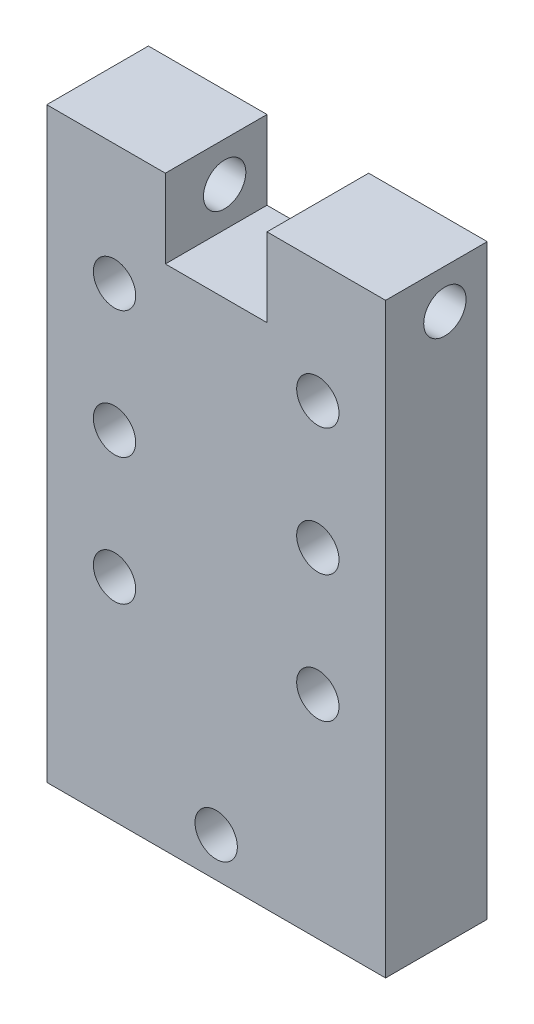
from build123d import *

# Parameters (mm, degrees)
SKETCH_1_W          = 40
SKETCH_1_H          = 69.282032302
EXTRUDE_1_DEPTH     = 12
SKETCH_2_R          = 2.5
SKETCH_2_W          = 12
SKETCH_2_H          = 9.282032302
CUT_EXTRUDE_1_DEPTH = 12
SKETCH_3_R          = 2.5
CUT_EXTRUDE_2_DEPTH = 60
SKETCH_4_R          = 2.5
CUT_EXTRUDE_3_DEPTH = 12
SKETCH_5_R          = 4.5
CUT_EXTRUDE_4_DEPTH = 3
SKETCH_6_R          = 2.5
CUT_EXTRUDE_5_DEPTH = 10


with BuildPart() as part:
    # 草图1 → 凸台-拉伸1 (new body)
    with BuildSketch(Plane.XY):
        Rectangle(SKETCH_1_W, SKETCH_1_H)
    extrude(amount=EXTRUDE_1_DEPTH)

    # 草图2 → 切除-拉伸1 (cut)
    with BuildSketch(Plane.XY.offset(12)):
        with Locations((0, -30)):
            Circle(SKETCH_2_R)
        with Locations((0, 30)):
            Rectangle(SKETCH_2_W, SKETCH_2_H)
    extrude(amount=-CUT_EXTRUDE_1_DEPTH, mode=Mode.SUBTRACT)

    # 草图3 → 切除-拉伸2 (cut)
    with BuildSketch(Plane.ZY.offset(20)):
        with Locations((5, 30)):
            Circle(SKETCH_3_R)
    extrude(amount=-CUT_EXTRUDE_2_DEPTH, mode=Mode.SUBTRACT)

    # 草图4 → 切除-拉伸3 (cut)
    with BuildSketch(Plane(origin=(0, 0, 0), x_dir=(-1, 0, 0), z_dir=(0, 0, -1))):
        with Locations((-12, -9.641016151)):
            Circle(SKETCH_4_R)
        with Locations((-12, 5.358983849)):
            Circle(SKETCH_4_R)
        with Locations((-12, 20.358983849)):
            Circle(SKETCH_4_R)
        with Locations(Location((12, 20.358983849, 0), (0, 0, 180))):
            Circle(SKETCH_4_R)
        with Locations(Location((12, 5.358983849, 0), (0, 0, 180))):
            Circle(SKETCH_4_R)
        with Locations(Location((12, -9.641016151, 0), (0, 0, 180))):
            Circle(SKETCH_4_R)
    extrude(amount=-CUT_EXTRUDE_3_DEPTH, mode=Mode.SUBTRACT)

    # 草图5 → 切除-拉伸4 (cut)
    with BuildSketch(Plane(origin=(0, 0, 0), x_dir=(-1, 0, 0), z_dir=(0, 0, -1))):
        with Locations((-12, -9.641016151)):
            Circle(SKETCH_5_R)
        with Locations((-12, 5.358983849)):
            Circle(SKETCH_5_R)
        with Locations((-12, 20.358983849)):
            Circle(SKETCH_5_R)
        with Locations((12, -9.641016151)):
            Circle(SKETCH_5_R)
        with Locations((12, 5.358983849)):
            Circle(SKETCH_5_R)
        with Locations((12, 20.358983849)):
            Circle(SKETCH_5_R)
    extrude(amount=-CUT_EXTRUDE_4_DEPTH, mode=Mode.SUBTRACT)

    # 草图6 → 切除-拉伸5 (cut)
    with BuildSketch(Plane.XZ.offset(34.641016151)):
        with Locations(Location((-10, 6, 0), (0, 0, 270))):
            Circle(SKETCH_6_R)
        with Locations(Location((10, 6, 0), (0, 0, 270))):
            Circle(SKETCH_6_R)
    extrude(amount=-CUT_EXTRUDE_5_DEPTH, mode=Mode.SUBTRACT)


solid = part.part
